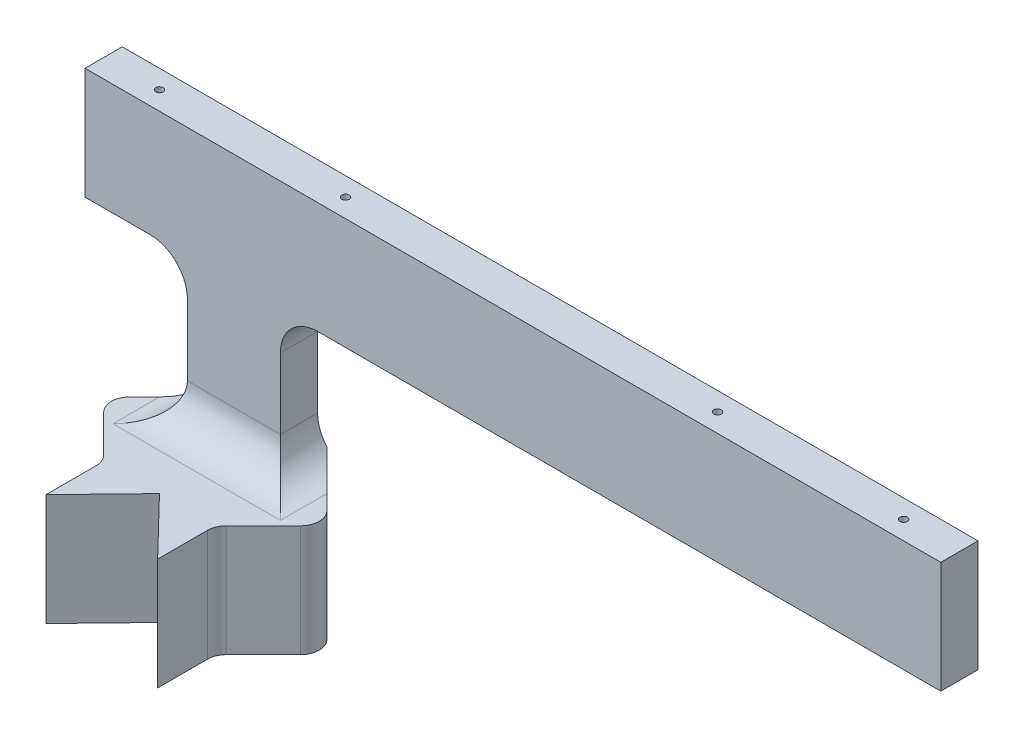
from build123d import *

# Parameters (mm, degrees)
SKETCH1_W           = 230
SKETCH1_H           = 30
BOSS_EXTRUDE1_DEPTH = 10
SKETCH2_R           = 1
CUT_EXTRUDE1_DEPTH  = 54
SKETCH3_W           = 25
SKETCH3_H           = 10
BOSS_EXTRUDE2_DEPTH = 54
FILLET1_R           = 10
SKETCH4_W           = 60
SKETCH4_H           = 30
BOSS_EXTRUDE3_DEPTH = 15
CUT_EXTRUDE3_DEPTH  = 40
BOSS_EXTRUDE4_DEPTH = 30
FILLET2_R           = 5
FILLET3_R           = 10


with BuildPart() as part:
    # Sketch1 → Boss-Extrude1 (new body)
    with BuildSketch(Plane.XY):
        Rectangle(SKETCH1_W, SKETCH1_H)
    extrude(amount=BOSS_EXTRUDE1_DEPTH)

    # Sketch2 → Cut-Extrude1 (cut)
    with BuildSketch(Plane(origin=(0, 15, 0), x_dir=(1, 0, 0), z_dir=(0, 1, 0))):
        with Locations(Location((50, -5, 0), (0, 0, 180))):
            Circle(SKETCH2_R)
        with Locations(Location((100, -5, 0), (0, 0, 180))):
            Circle(SKETCH2_R)
        with Locations(Location((-100, -5, 0), (0, 0, 180))):
            Circle(SKETCH2_R)
        with Locations(Location((-50, -5, 0), (0, 0, 180))):
            Circle(SKETCH2_R)
    extrude(amount=-CUT_EXTRUDE1_DEPTH, mode=Mode.SUBTRACT)

    # Sketch3 → Boss-Extrude2 (add)
    with BuildSketch(Plane.XZ.offset(15)):
        with Locations((-75, 5)):
            Rectangle(SKETCH3_W, SKETCH3_H)
    extrude(amount=BOSS_EXTRUDE2_DEPTH)

    # Fillet1
    fillet1_edges = [part.edges().sort_by_distance(p)[0] for p in [
        (-87.5, -15, 5),
        (-62.5, -15, 5),
    ]]
    fillet(fillet1_edges, radius=FILLET1_R)

    # Sketch4 → Boss-Extrude3 (add, symmetric)
    with BuildSketch(Plane.XZ.offset(69)):
        with Locations((-75, 15)):
            Rectangle(SKETCH4_W, SKETCH4_H)
    extrude(amount=BOSS_EXTRUDE3_DEPTH, both=True)

    # Sketch6 → Cut-Extrude3 (cut)
    with BuildSketch(Plane.XZ.offset(84)):
        Polygon((-105, 30), (-105, 14.999997289), (-90, 30), align=None)
        Polygon((-90, 0), (-105, 14.999997289), (-105, 0), align=None)
        Polygon((-45, 30), (-60, 30), (-45, 14.999997289), align=None)
        Polygon((-45, 14.999997289), (-60, 0), (-45, 0), align=None)
    extrude(amount=-CUT_EXTRUDE3_DEPTH, mode=Mode.SUBTRACT)

    # Sketch7 → Boss-Extrude4 (add)
    with BuildSketch(Plane.XZ.offset(84)):
        Polygon((-75, 30), (-90, 45.499997289), (-90, 30), align=None)
        Polygon((-60, 45.499997289), (-75, 30), (-60, 30), align=None)
    extrude(amount=-BOSS_EXTRUDE4_DEPTH)

    # Fillet2
    fillet2_edges = [part.edges().sort_by_distance(p)[0] for p in [
        (-45, -69, 14.999997289),
        (-60, -69, 30),
        (-105, -69, 14.999997289),
        (-90, -69, 30),
    ]]
    fillet(fillet2_edges, radius=FILLET2_R)

    # Fillet3
    fillet3_edges = [part.edges().sort_by_distance(p)[0] for p in [
        (-62.5, -54, 5),
        (-87.5, -54, 5),
        (-75, -54, 10),
    ]]
    fillet(fillet3_edges, radius=FILLET3_R)


solid = part.part
